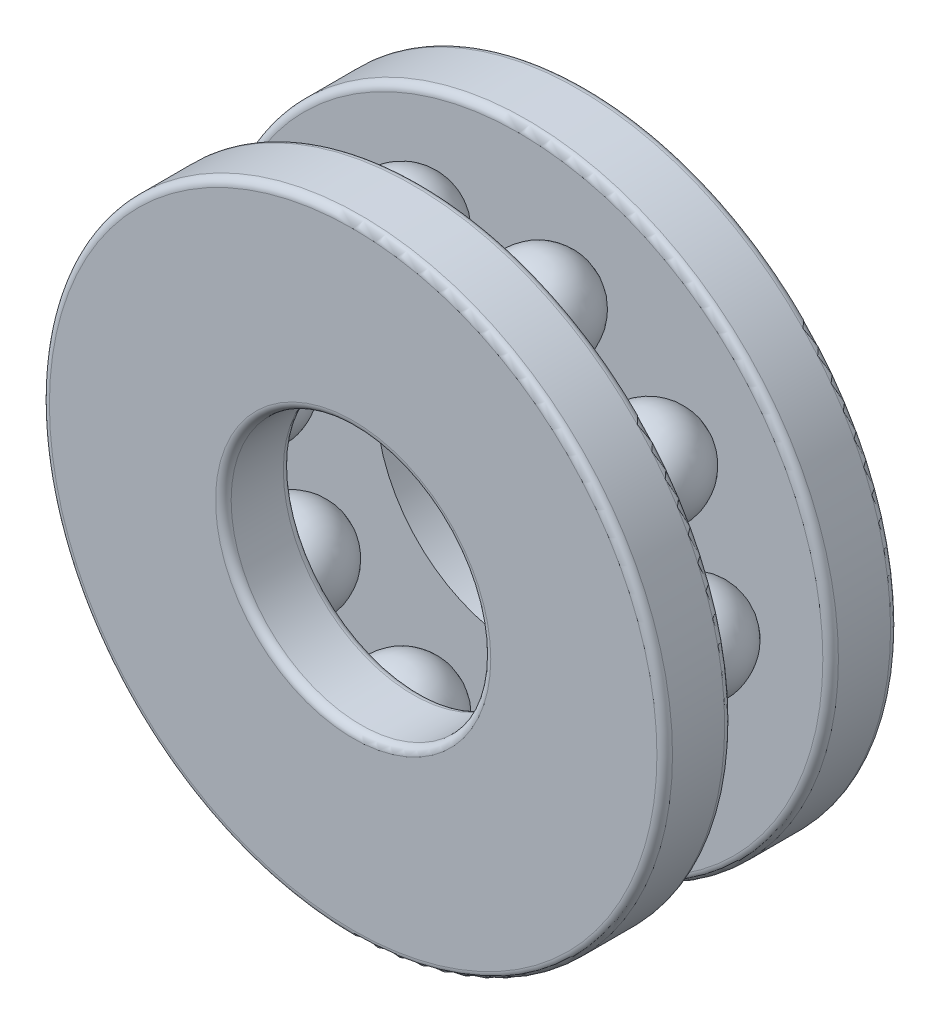
from build123d import *

# Parameters (mm, degrees)
SHAFTWASHERS_W     = 7
SHAFTWASHERS_H     = 2.61
HOUSINGWASHERS_W   = 6.5
HOUSINGWASHERS_H   = 2.61
BALLSPATTERN_COUNT = 10
FILLET_F1_R        = 0.3
FILLET_F2_R        = 0.3


with BuildPart() as part:
    # ShaftWasherS → ShaftWasher (revolve)
    with BuildSketch(Plane(origin=(0, 0, 0), x_dir=(1, 0, 0), z_dir=(0, 1, 0))):
        with Locations((8.5, -3.195)):
            Rectangle(SHAFTWASHERS_W, SHAFTWASHERS_H)
    revolve(axis=Axis((0, 0, 7.75), (0, 0, -1)))

    # Fillet F2
    fillet_f2_edges = [part.edges().sort_by_distance(p)[0] for p in [
        (-5, 0, 1.89),
        (-12, 0, 1.89),
        (-12, 0, 4.5),
        (-5, 0, 4.5),
    ]]
    fillet(fillet_f2_edges, radius=FILLET_F2_R)


with BuildPart() as body_2:
    # HousingWasherS → HousingWasher (revolve)
    with BuildSketch(Plane(origin=(0, 0, 0), x_dir=(1, 0, 0), z_dir=(0, 1, 0))):
        with Locations((8.75, 3.195)):
            Rectangle(HOUSINGWASHERS_W, HOUSINGWASHERS_H)
    revolve(axis=Axis((0, 0, 7.75), (0, 0, -1)))

    # Fillet F1
    fillet_f1_edges = [body_2.edges().sort_by_distance(p)[0] for p in [
        (-12, 0, -4.5),
        (-12, 0, -1.89),
    ]]
    fillet(fillet_f1_edges, radius=FILLET_F1_R)


with BuildPart() as body_3:
    # BallS → Ball (revolve)
    with BuildSketch(Plane(origin=(0, 0, 0), x_dir=(1, 0, 0), z_dir=(0, 1, 0))):
        with BuildLine():
            Line((6.61, 0), (10.39, 0))
            ThreePointArc((10.39, 0), (8.5, -1.89), (6.61, 0))
        make_face()
    revolve(axis=Axis((6.61, 0, 0), (1, 0, 0)))


with BuildPart() as ballspattern_1:
    # BallsPattern: pattern copy
    add(body_3.part.rotate(Axis((0, 0, -4.95), (0, 0, 1)), 1 * 360 / BALLSPATTERN_COUNT))


with BuildPart() as ballspattern_2:
    # BallsPattern: pattern copy
    add(body_3.part.rotate(Axis((0, 0, -4.95), (0, 0, 1)), 2 * 360 / BALLSPATTERN_COUNT))


with BuildPart() as ballspattern_3:
    # BallsPattern: pattern copy
    add(body_3.part.rotate(Axis((0, 0, -4.95), (0, 0, 1)), 3 * 360 / BALLSPATTERN_COUNT))


with BuildPart() as ballspattern_4:
    # BallsPattern: pattern copy
    add(body_3.part.rotate(Axis((0, 0, -4.95), (0, 0, 1)), 4 * 360 / BALLSPATTERN_COUNT))


with BuildPart() as ballspattern_5:
    # BallsPattern: pattern copy
    add(body_3.part.rotate(Axis((0, 0, -4.95), (0, 0, 1)), 5 * 360 / BALLSPATTERN_COUNT))


with BuildPart() as ballspattern_6:
    # BallsPattern: pattern copy
    add(body_3.part.rotate(Axis((0, 0, -4.95), (0, 0, 1)), 6 * 360 / BALLSPATTERN_COUNT))


with BuildPart() as ballspattern_7:
    # BallsPattern: pattern copy
    add(body_3.part.rotate(Axis((0, 0, -4.95), (0, 0, 1)), 7 * 360 / BALLSPATTERN_COUNT))


with BuildPart() as ballspattern_8:
    # BallsPattern: pattern copy
    add(body_3.part.rotate(Axis((0, 0, -4.95), (0, 0, 1)), 8 * 360 / BALLSPATTERN_COUNT))


with BuildPart() as ballspattern_9:
    # BallsPattern: pattern copy
    add(body_3.part.rotate(Axis((0, 0, -4.95), (0, 0, 1)), 9 * 360 / BALLSPATTERN_COUNT))


solid = Compound([part.part, body_2.part, body_3.part, ballspattern_1.part, ballspattern_2.part, ballspattern_3.part, ballspattern_4.part, ballspattern_5.part, ballspattern_6.part, ballspattern_7.part, ballspattern_8.part, ballspattern_9.part])
